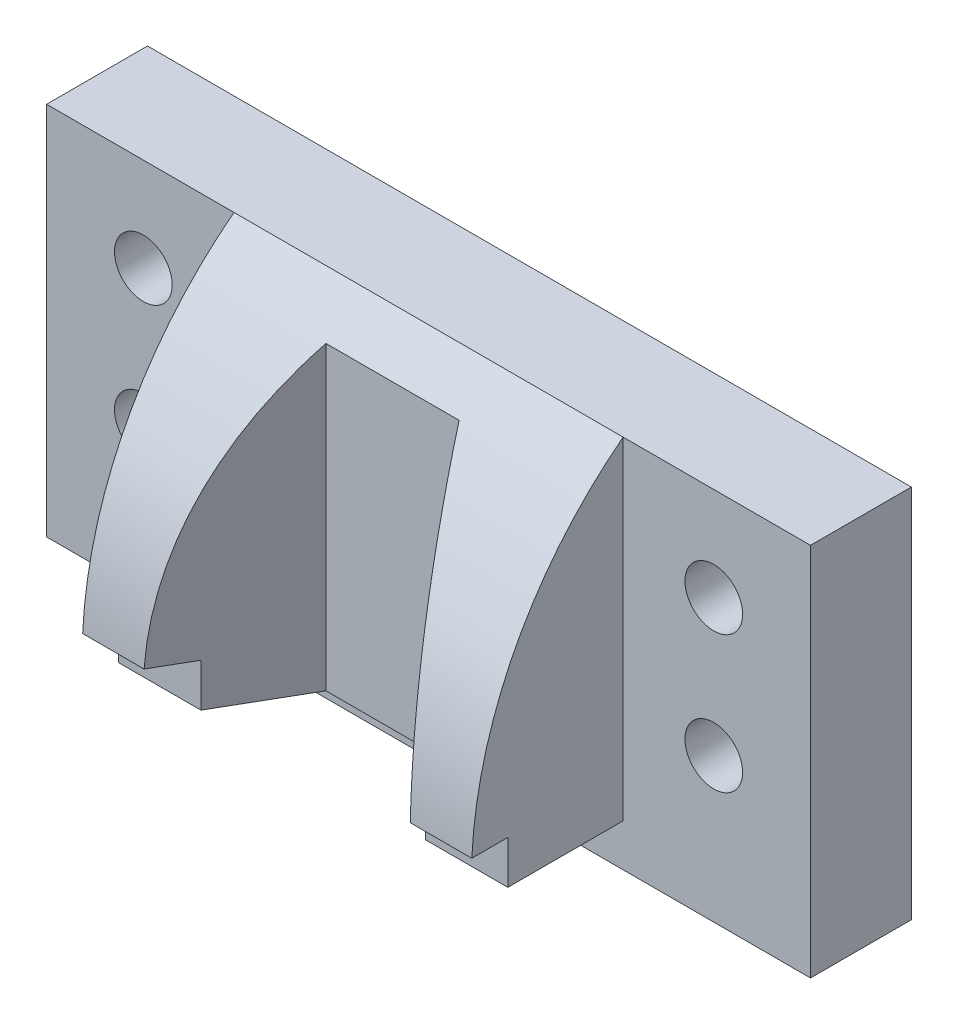
from build123d import *

# Parameters (mm, degrees)
SKETCH1_W           = 106
SKETCH1_H           = 52
BOSS_EXTRUDE1_DEPTH = 14
SKETCH2_R           = 4
CUT_EXTRUDE1_DEPTH  = 14
BOSS_EXTRUDE2_DEPTH = 27
CUT_EXTRUDE2_DEPTH  = 79.485834959


with BuildPart() as part:
    # Sketch1 → Boss-Extrude1 (new body)
    with BuildSketch(Plane.XY):
        Rectangle(SKETCH1_W, SKETCH1_H)
    extrude(amount=BOSS_EXTRUDE1_DEPTH)

    # Sketch2 → Cut-Extrude1 (cut)
    with BuildSketch(Plane.XY.offset(14)):
        with Locations((39.576420428, 13)):
            Circle(SKETCH2_R)
        with Locations((39.576420428, -6)):
            Circle(SKETCH2_R)
    cut_extrude1 = extrude(amount=-CUT_EXTRUDE1_DEPTH, mode=Mode.SUBTRACT)

    # Mirror1: Cut-Extrude1 across plane
    add(cut_extrude1.mirror(Plane.ZY), mode=Mode.SUBTRACT)

    # Sketch4 → Boss-Extrude2 (add, symmetric)
    with BuildSketch(Plane.ZY):
        with BuildLine():
            Line((14, 26), (14, -20.108852612))
            Line((14, -20.108852612), (30, -20.108852612))
            Line((30, -20.108852612), (30, -14.108852612))
            Line((30, -14.108852612), (35, -14.108852612))
            ThreePointArc((35, -14.108852612), (28.906357886, 8.252633347), (14, 26))
        make_face()
    extrude(amount=BOSS_EXTRUDE2_DEPTH, both=True)

    # Sketch6 → Cut-Extrude2 (cut, through all)
    with BuildSketch(Plane.XZ.offset(20.108852612)):
        Polygon((-9.237604307, 19), (-18.475208614, 35), (18.475208614, 35), (9.237604307, 19), align=None)
    extrude(amount=-CUT_EXTRUDE2_DEPTH, mode=Mode.SUBTRACT)


solid = part.part
